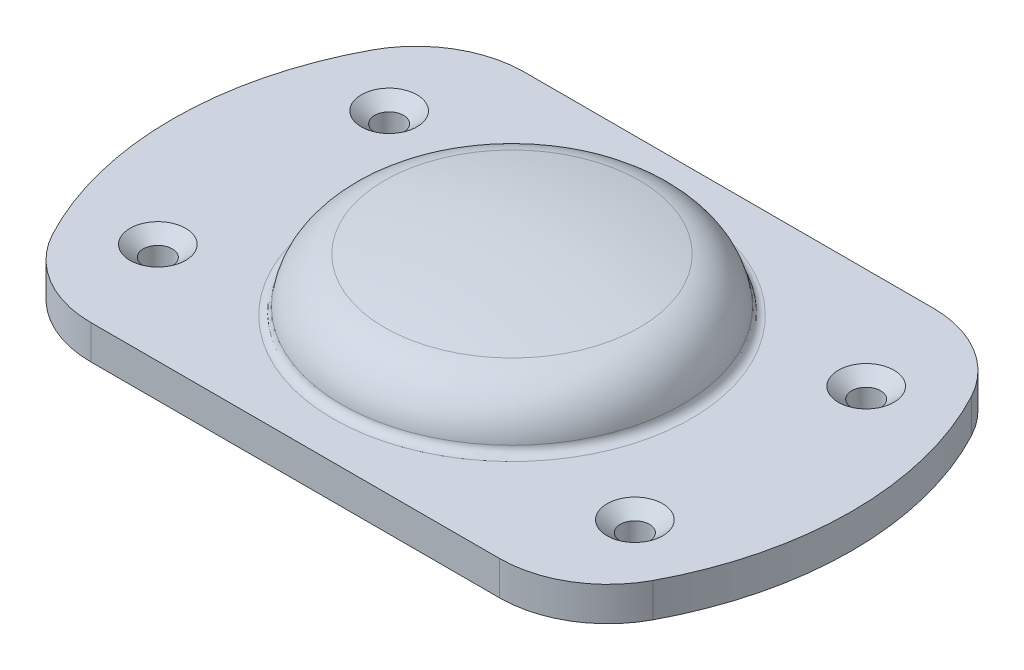
from build123d import *

# Parameters (mm, degrees)
BOSS_EXTRUDE1_DEPTH                                = 5.9944
FILLET1_R                                          = 1.5875
CSK_FOR_10_FLAT_HEAD_MACHINE_SCREW_100_D           = 5.1054
CSK_FOR_10_FLAT_HEAD_MACHINE_SCREW_100_CSINK_D     = 9.779
CSK_FOR_10_FLAT_HEAD_MACHINE_SCREW_100_CSINK_ANGLE = 100


with BuildPart() as part:
    # Sketch1 → Boss-Extrude1 (new body)
    with BuildSketch(Plane(origin=(0, 0, 0), x_dir=(1, 0, 0), z_dir=(0, 1, 0))):
        with BuildLine():
            Line((-35.898566824, -38.1), (35.898566824, -38.1))
            ThreePointArc((35.898566824, -38.1), (45.716712095, -35.375027517), (52.726020022, -27.9796875))
            ThreePointArc((52.726020022, -27.9796875), (59.69, 0), (52.726020022, 27.9796875))
            ThreePointArc((52.726020022, 27.9796875), (45.716712095, 35.375027517), (35.898566824, 38.1))
            Line((35.898566824, 38.1), (-35.898566824, 38.1))
            ThreePointArc((-35.898566824, 38.1), (-45.716712095, 35.375027517), (-52.726020022, 27.9796875))
            ThreePointArc((-52.726020022, 27.9796875), (-59.69, 0), (-52.726020022, -27.9796875))
            ThreePointArc((-52.726020022, -27.9796875), (-45.716712095, -35.375027517), (-35.898566824, -38.1))
        make_face()
    extrude(amount=BOSS_EXTRUDE1_DEPTH)

    # Sketch3 → Revolve1 (revolve)
    with BuildSketch(Plane.XY, mode=Mode.PRIVATE) as revolve1_sk:
        with BuildLine():
            Line((-29.9974, 5.9944), (0, 5.9944))
            Line((0, 5.9944), (0, 17.6022))
            ThreePointArc((0, 17.6022), (-11.253106327, 17.031245116), (-22.39063481, 15.324244597))
            ThreePointArc((-22.39063481, 15.324244597), (-27.854703555, 12.013305151), (-29.9974, 5.9944))
        make_face()
    revolve(revolve1_sk.sketch.rotate(Axis((0, 17.6022, 0), (0, -1, 0)), 180), axis=Axis((0, 17.6022, 0), (0, -1, 0)))

    # Fillet1
    fillet1_edges = [part.edges().sort_by_distance(p)[0] for p in [
        (-29.9974, 5.9944, 0),
    ]]
    fillet(fillet1_edges, radius=FILLET1_R)

    # CSK for #10 Flat Head Machine Screw (100)1 (through all)
    with Locations(Plane(origin=(0, 5.9944, 0), x_dir=(-1, 0, 0), z_dir=(0, 1, 0))):
        with Locations((41.91, -20.32), (41.91, 20.32), (-41.91, -20.32), (-41.91, 20.32)):
            CounterSinkHole(CSK_FOR_10_FLAT_HEAD_MACHINE_SCREW_100_D / 2, CSK_FOR_10_FLAT_HEAD_MACHINE_SCREW_100_CSINK_D / 2, counter_sink_angle=CSK_FOR_10_FLAT_HEAD_MACHINE_SCREW_100_CSINK_ANGLE)


solid = part.part
